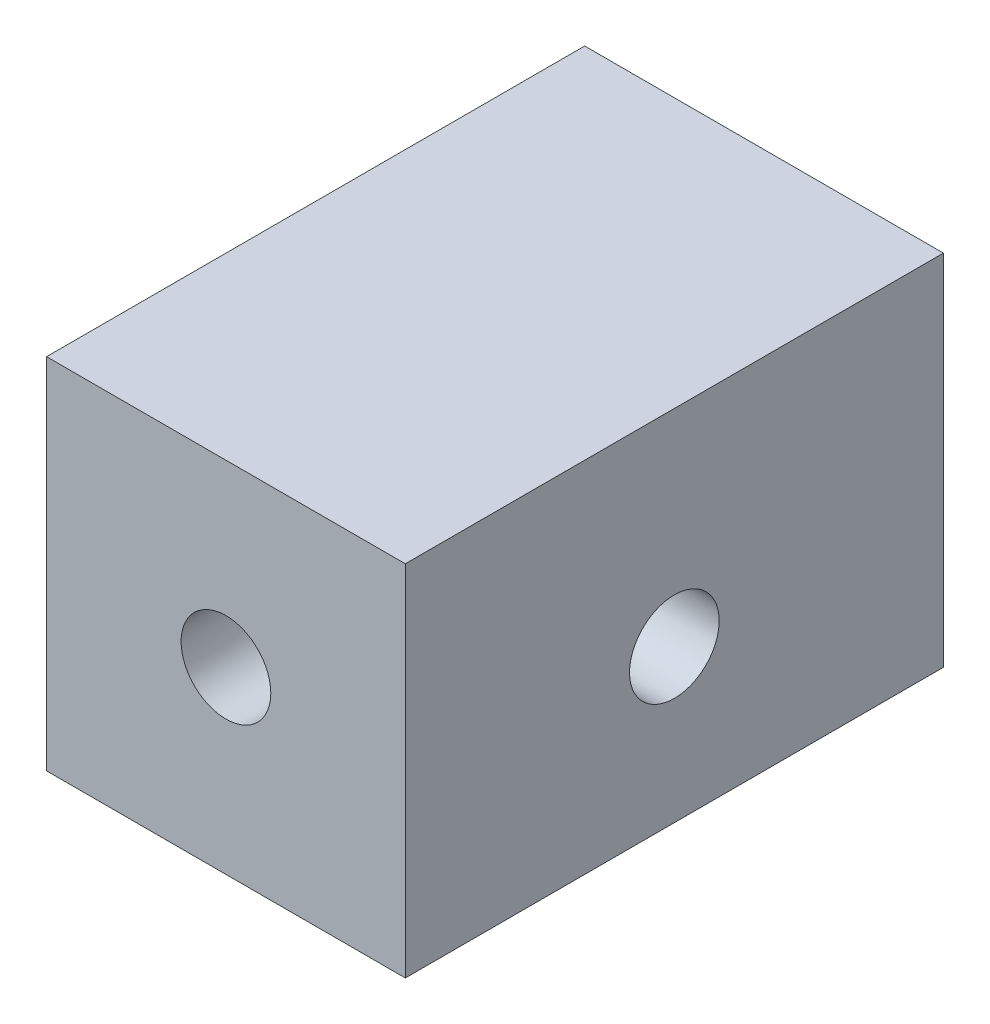
from build123d import *

# Parameters (mm, degrees)
SKETCH1_W           = 25.4
SKETCH1_H           = 25.4
BOSS_EXTRUDE1_DEPTH = 38.1
SKETCH3_R           = 3.175
CUT_EXTRUDE1_DEPTH  = 12.7
SKETCH2_R           = 3.175
CUT_EXTRUDE2_DEPTH  = 48.519048812


with BuildPart() as part:
    # Sketch1 → Boss-Extrude1 (new body)
    with BuildSketch(Plane.XY):
        Rectangle(SKETCH1_W, SKETCH1_H)
    extrude(amount=BOSS_EXTRUDE1_DEPTH)

    # Sketch3 → Cut-Extrude1 (cut)
    with BuildSketch(Plane.XY.offset(38.1)):
        Circle(SKETCH3_R)
    extrude(amount=-CUT_EXTRUDE1_DEPTH, mode=Mode.SUBTRACT)

    # Sketch2 → Cut-Extrude2 (cut, through all)
    with BuildSketch(Plane.ZY.offset(12.7)):
        with Locations((19.05, -1.905)):
            Circle(SKETCH2_R)
    extrude(amount=-CUT_EXTRUDE2_DEPTH, mode=Mode.SUBTRACT)


solid = part.part
